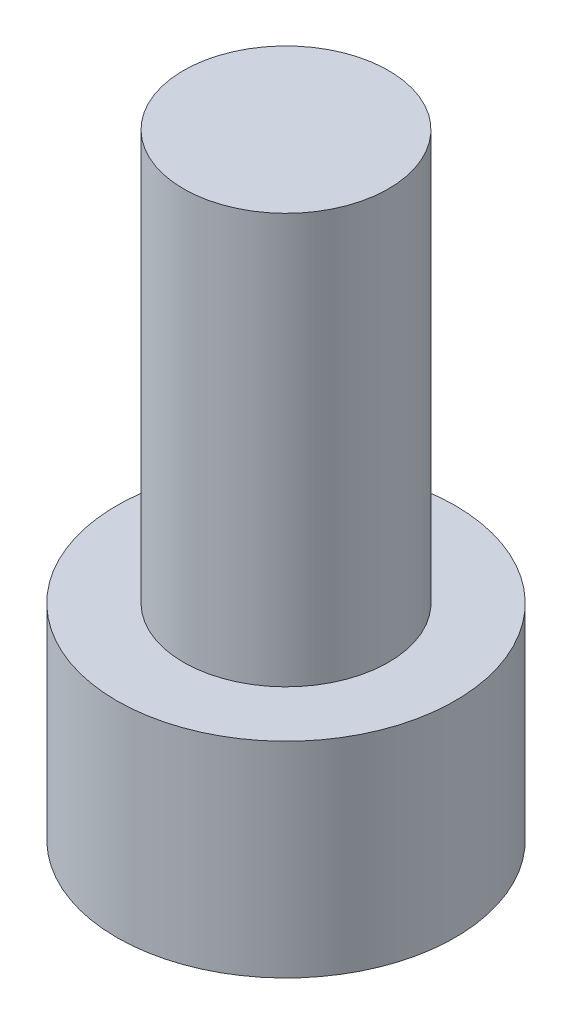
from build123d import *

# Parameters (mm, degrees)
SKETCH_1_R          = 6.6
EXTRUDE_1_DEPTH     = 8
SKETCH_2_R          = 4
EXTRUDE_2_DEPTH     = 16
CUT_EXTRUDE_1_DEPTH = 4


with BuildPart() as part:
    # 草图1 → 凸台-拉伸1 (new body)
    with BuildSketch(Plane(origin=(0, 0, 0), x_dir=(1, 0, 0), z_dir=(0, 1, 0))):
        with Locations(Location((0, 0, 0), (0, 0, 270))):
            Circle(SKETCH_1_R)
    extrude(amount=EXTRUDE_1_DEPTH)

    # 草图2 → 凸台-拉伸2 (add)
    with BuildSketch(Plane(origin=(0, 8, 0), x_dir=(1, 0, 0), z_dir=(0, 1, 0))):
        with Locations(Location((0, 0, 0), (0, 0, 270))):
            Circle(SKETCH_2_R)
    extrude(amount=EXTRUDE_2_DEPTH)

    # 草图3 → 切除-拉伸1 (cut)
    with BuildSketch(Plane.XZ):
        Polygon((2.805209528, -2.032436839), (3.162746698, 1.413164294), (0.357537171, 3.445601134), (-2.805209528, 2.032436839), (-3.162746698, -1.413164294), (-0.357537171, -3.445601134), align=None)
    extrude(amount=-CUT_EXTRUDE_1_DEPTH, mode=Mode.SUBTRACT)


solid = part.part
